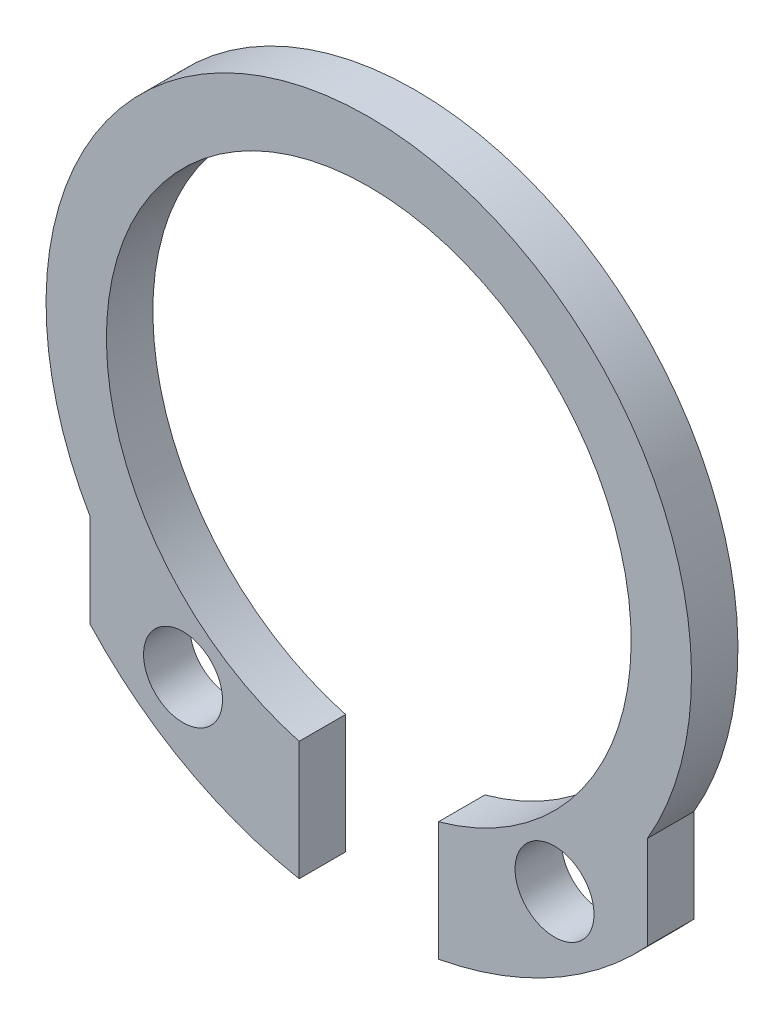
from build123d import *

# Parameters (mm, degrees)
SKETCH_1_R      = 0.85
EXTRUDE_1_DEPTH = 1


with BuildPart() as part:
    # 草图1 → 凸台-拉伸1 (new body)
    with BuildSketch(Plane.XY):
        with BuildLine():
            Line((6, -3.507491981), (6, -5.515659525))
            ThreePointArc((6, -5.515659525), (3.952075284, -7.12766448), (1.5, -8.010773995))
            Line((1.5, -8.010773995), (1.5, -5.447247011))
            ThreePointArc((1.5, -5.447247011), (0, 5.65), (-1.5, -5.447247011))
            Line((-1.5, -5.447247011), (-1.5, -8.010773995))
            ThreePointArc((-1.5, -8.010773995), (-3.952075284, -7.12766448), (-6, -5.515659525))
            Line((-6, -5.515659525), (-6, -3.507491981))
            ThreePointArc((-6, -3.507491981), (0, 6.95), (6, -3.507491981))
        make_face()
        with Locations((4, -5.5)):
            Circle(SKETCH_1_R, mode=Mode.SUBTRACT)
        with Locations((-4, -5.5)):
            Circle(SKETCH_1_R, mode=Mode.SUBTRACT)
    extrude(amount=EXTRUDE_1_DEPTH)


solid = part.part
